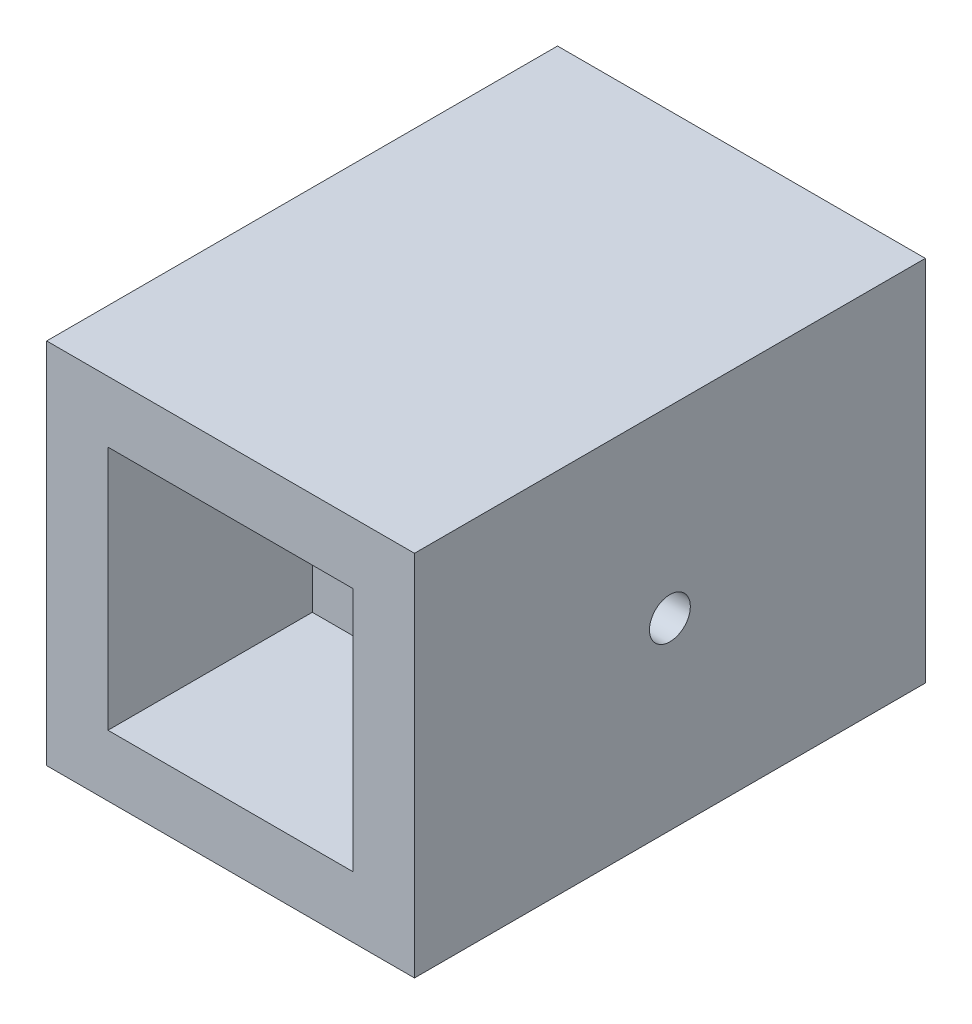
from build123d import *

# Parameters (mm, degrees)
SKETCH_1_W          = 18
SKETCH_1_H          = 18
EXTRUDE_2_DEPTH     = 25
SKETCH_2_W          = 12
SKETCH_2_H          = 12
CUT_EXTRUDE_1_DEPTH = 10
SKETCH_4_W          = 12
SKETCH_4_H          = 12
CUT_EXTRUDE_3_DEPTH = 10
SKETCH_5_R          = 1
CUT_EXTRUDE_4_DEPTH = 18


with BuildPart() as part:
    # 草图1 → 凸台-拉伸2 (new body)
    with BuildSketch(Plane.XY):
        with Locations((9, 9)):
            Rectangle(SKETCH_1_W, SKETCH_1_H)
    extrude(amount=EXTRUDE_2_DEPTH)

    # 草图2 → 切除-拉伸1 (cut)
    with BuildSketch(Plane(origin=(0, 0, 0), x_dir=(-1, 0, 0), z_dir=(0, 0, -1))):
        with Locations((-9, 9)):
            Rectangle(SKETCH_2_W, SKETCH_2_H)
    extrude(amount=-CUT_EXTRUDE_1_DEPTH, mode=Mode.SUBTRACT)

    # 草图4 → 切除-拉伸3 (cut)
    with BuildSketch(Plane.XY.offset(25)):
        with Locations((9, 9)):
            Rectangle(SKETCH_4_W, SKETCH_4_H)
    extrude(amount=-CUT_EXTRUDE_3_DEPTH, mode=Mode.SUBTRACT)

    # 草图5 → 切除-拉伸4 (cut)
    with BuildSketch(Plane(origin=(18, 0, 0), x_dir=(0, 0, -1), z_dir=(1, 0, 0))):
        with Locations((-12.5, 9)):
            Circle(SKETCH_5_R)
    extrude(amount=-CUT_EXTRUDE_4_DEPTH, mode=Mode.SUBTRACT)


solid = part.part
